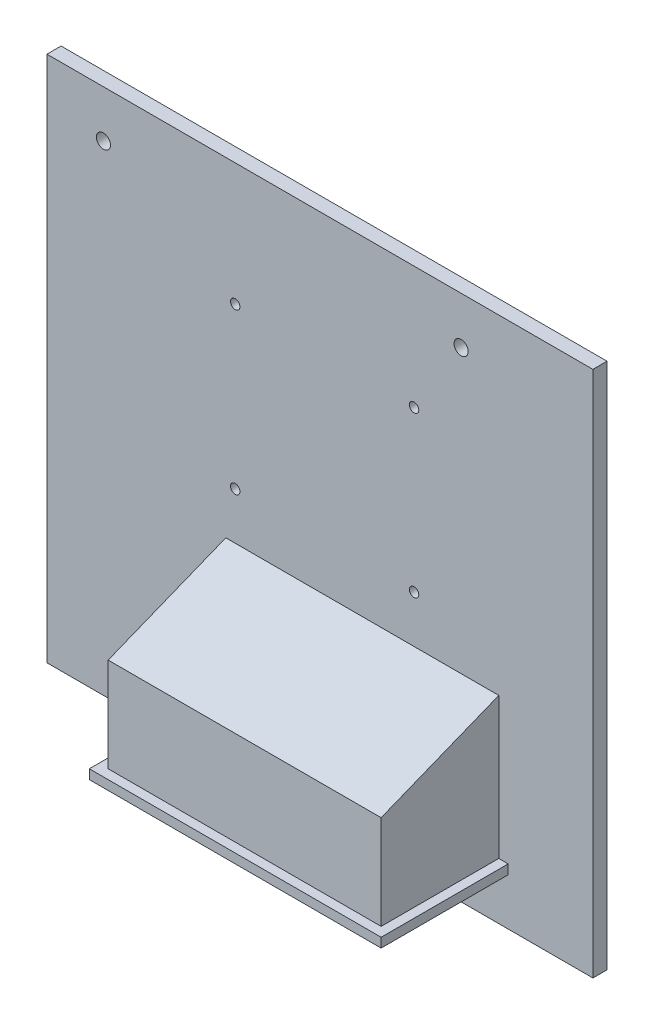
from build123d import *

# Parameters (mm, degrees)
CROQUIS1_W              = 116
CROQUIS1_H              = 112
SALIENTE_EXTRUIR1_DEPTH = 3
CROQUIS2_W              = 58
CROQUIS2_H              = 34
SALIENTE_EXTRUIR2_DEPTH = 25
CROQUIS3_W              = 62
CROQUIS3_H              = 27
SALIENTE_EXTRUIR3_DEPTH = 2
CORTAR_EXTRUIR1_DEPTH   = 116.117331449
CROQUIS5_R              = 1.5
CROQUIS5_R_2            = 1
CORTAR_EXTRUIR2_DEPTH   = 86.023526156


with BuildPart() as part:
    # Croquis1 → Saliente-Extruir1 (new body)
    with BuildSketch(Plane.XY):
        Rectangle(CROQUIS1_W, CROQUIS1_H)
    extrude(amount=SALIENTE_EXTRUIR1_DEPTH)

    # Croquis2 → Saliente-Extruir2 (add)
    with BuildSketch(Plane.XY.offset(3)):
        with Locations((9, -31)):
            Rectangle(CROQUIS2_W, CROQUIS2_H)
    extrude(amount=SALIENTE_EXTRUIR2_DEPTH)

    # Croquis3 → Saliente-Extruir3 (add)
    with BuildSketch(Plane(origin=(0, -46, 0), x_dir=(-1, 0, 0), z_dir=(0, -1, 0))):
        with Locations((-9, -16.5)):
            Rectangle(CROQUIS3_W, CROQUIS3_H)
    extrude(amount=-SALIENTE_EXTRUIR3_DEPTH)

    # Croquis4 → Cortar-Extruir1 (cut, through all)
    with BuildSketch(Plane(origin=(38, 0, 0), x_dir=(0, 0, -1), z_dir=(1, 0, 0))):
        Polygon((-3, -14), (-28, -24.000473789), (-28, -14), align=None)
    extrude(amount=-CORTAR_EXTRUIR1_DEPTH, mode=Mode.SUBTRACT)

    # Croquis5 → Cortar-Extruir2 (cut, through all)
    with BuildSketch(Plane.XY.offset(3)):
        with Locations((-36, -46)):
            Circle(CROQUIS5_R)
        with Locations((-46, 46)):
            Circle(CROQUIS5_R)
        with Locations((30, 46)):
            Circle(CROQUIS5_R)
        with Locations((20, 30)):
            Circle(CROQUIS5_R_2)
        with Locations((20, -4)):
            Circle(CROQUIS5_R_2)
        with Locations((-18, -4)):
            Circle(CROQUIS5_R_2)
        with Locations((-18, 30)):
            Circle(CROQUIS5_R_2)
    extrude(amount=-CORTAR_EXTRUIR2_DEPTH, mode=Mode.SUBTRACT)


solid = part.part
